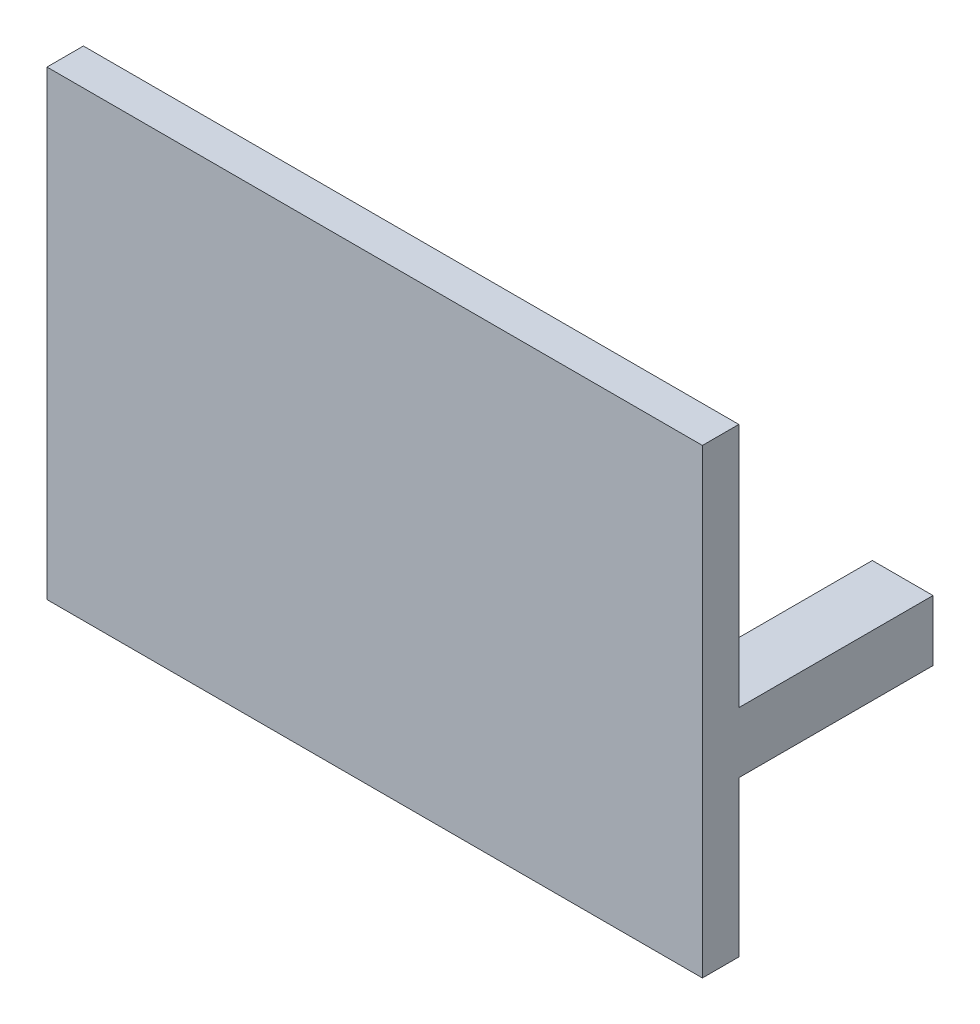
from build123d import *

# Parameters (mm, degrees)
SKETCH1_W           = 54
SKETCH1_H           = 38
BOSS_EXTRUDE1_DEPTH = 3
SKETCH2_W           = 5
SKETCH2_H           = 5
SKETCH2_R           = 1.6
BOSS_EXTRUDE2_DEPTH = 16


with BuildPart() as part:
    # Sketch1 → Boss-Extrude1 (new body)
    with BuildSketch(Plane.XY):
        with Locations((27, 19)):
            Rectangle(SKETCH1_W, SKETCH1_H)
    extrude(amount=BOSS_EXTRUDE1_DEPTH)

    # Sketch2 → Boss-Extrude2 (add)
    # profile 1 of 2: a face of its own
    with BuildSketch(Plane.XY):
        with Locations((12.9, 7.7)):
            Rectangle(SKETCH2_W, SKETCH2_H)
        with Locations((12.9, 7.7)):
            Circle(SKETCH2_R, mode=Mode.SUBTRACT)
    # profile 2 of 2: a face of its own
    with BuildSketch(Plane.XY):
        with Locations((51.5, 15.29)):
            Rectangle(SKETCH2_W, SKETCH2_H)
        with Locations((51.5, 15.29)):
            Circle(SKETCH2_R, mode=Mode.SUBTRACT)
    extrude(amount=-BOSS_EXTRUDE2_DEPTH)


solid = part.part
